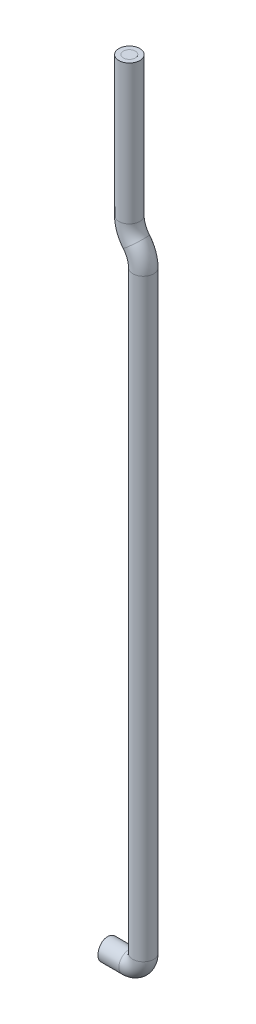
from build123d import *

# Parameters (mm, degrees)
SKETCH_1_R          = 1.05
SKETCH_3_R          = 0.6
SKETCH_4_R          = 0.6
SKETCH_5_R          = 0.6
SKETCH_7_R          = 1.05
SKETCH_7_R_2        = 0.6
CUT_EXTRUDE_2_DEPTH = 3
CUT_EXTRUDE_3_DEPTH = 3


with BuildPart() as part:
    # Sweep 1: sweep along a path in Эскиз2
    with BuildLine(Plane.XY) as sweep_1_path:
        Line((0, 0), (0, 59.64772794))
        ThreePointArc((0, 59.64772794), (-0.180425564, 60.672423017), (-0.7, 61.573863968))
        ThreePointArc((-0.7, 61.573863968), (-1.219574436, 62.47530492), (-1.4, 63.499999997))
        Line((-1.4, 63.499999997), (-1.4, 77.499999997))
    # Эскиз1 → Sweep 1 (sweep)
    with BuildSketch(Plane(origin=(0, 0, 0), x_dir=(1, 0, 0), z_dir=(0, 1, 0))):
        Circle(SKETCH_1_R)
    sweep(path=sweep_1_path.line)

    # Sweep 1 2: sweep along a path in Эскиз2<2>
    with BuildLine(Plane.XY) as sweep_1_2_path:
        Line((0, 0), (0, 59.64772794))
        ThreePointArc((0, 59.64772794), (-0.180425564, 60.672423017), (-0.7, 61.573863968))
        ThreePointArc((-0.7, 61.573863968), (-1.219574436, 62.47530492), (-1.4, 63.499999997))
        Line((-1.4, 63.499999997), (-1.4, 77.499999997))
    # Эскиз3 → Sweep 1 2 (sweep, cut)
    with BuildSketch(Plane.XZ):
        Circle(SKETCH_3_R)
    sweep(path=sweep_1_2_path.line, mode=Mode.SUBTRACT)

    # По траектории4: sweep along a path in Эскиз6<2>
    with BuildLine(Plane.XY) as sweep_4_path:
        Line((-3.6, -1.4), (-1.4, -1.4))
        ThreePointArc((-1.4, -1.4), (-0.410050506, -0.989949494), (0, 0))
    # Эскиз7 → По траектории4 (sweep)
    with BuildSketch(Plane.XZ):
        Circle(SKETCH_7_R)
        Circle(SKETCH_7_R_2, mode=Mode.SUBTRACT)
    sweep(path=sweep_4_path.line)


with BuildPart() as body_2:
    # По траектории2: sweep along a path in Эскиз2<3>
    with BuildLine(Plane.XY) as sweep_2_path:
        Line((0, 0), (0, 59.64772794))
        ThreePointArc((0, 59.64772794), (-0.180425564, 60.672423017), (-0.7, 61.573863968))
        ThreePointArc((-0.7, 61.573863968), (-1.219574436, 62.47530492), (-1.4, 63.499999997))
        Line((-1.4, 63.499999997), (-1.4, 77.499999997))
    # Эскиз4 → По траектории2 (sweep)
    with BuildSketch(Plane.XZ):
        Circle(SKETCH_4_R)
    sweep(path=sweep_2_path.line)

    # По траектории3: sweep along a path in Эскиз6
    with BuildLine(Plane.XY) as sweep_3_path:
        Line((-3.6, -1.4), (-1.4, -1.4))
        ThreePointArc((-1.4, -1.4), (-0.410050506, -0.989949494), (0, 0))
    # Эскиз5 → По траектории3 (sweep)
    with BuildSketch(Plane.XZ):
        Circle(SKETCH_5_R)
    sweep(path=sweep_3_path.line)


with BuildPart() as cut_extrude_2_tool:
    # Эскиз8 → Вырез-Вытянуть2 (new body)
    with BuildSketch(Plane(origin=(0, -2.45, 0), x_dir=(-1, 0, 0), z_dir=(0, -1, 0))):
        with BuildLine():
            ThreePointArc((3.5074106, 1.05), (3.576807827, 0.52703719), (3.6, 0))
            Line((3.6, 0), (3.6, 1.05))
            Line((3.6, 1.05), (3.5074106, 1.05))
        make_face()
    extrude(amount=-CUT_EXTRUDE_2_DEPTH)


with BuildPart() as part_1:
    add(part.part)

    # Вырез-Вытянуть2: cut by cut_extrude_2_tool
    add(cut_extrude_2_tool.part, mode=Mode.SUBTRACT)


with BuildPart() as body_2_1:
    add(body_2.part)

    # Вырез-Вытянуть2: cut by cut_extrude_2_tool
    add(cut_extrude_2_tool.part, mode=Mode.SUBTRACT)


with BuildPart() as cut_extrude_3_tool:
    # Эскиз8<3> → Вырез-Вытянуть3 (new body)
    with BuildSketch(Plane(origin=(0, -2.45, 0), x_dir=(-1, 0, 0), z_dir=(0, -1, 0))):
        with BuildLine():
            Line((3.5074106, -1.05), (3.6, -1.05))
            Line((3.6, -1.05), (3.6, 0))
            ThreePointArc((3.6, 0), (3.576807827, -0.52703719), (3.5074106, -1.05))
        make_face()
    extrude(amount=-CUT_EXTRUDE_3_DEPTH)


with BuildPart() as part_2:
    add(part_1.part)

    # Вырез-Вытянуть3: cut by cut_extrude_3_tool
    add(cut_extrude_3_tool.part, mode=Mode.SUBTRACT)


with BuildPart() as body_2_2:
    add(body_2_1.part)

    # Вырез-Вытянуть3: cut by cut_extrude_3_tool
    add(cut_extrude_3_tool.part, mode=Mode.SUBTRACT)


solid = Compound([part_2.part, body_2_2.part])
